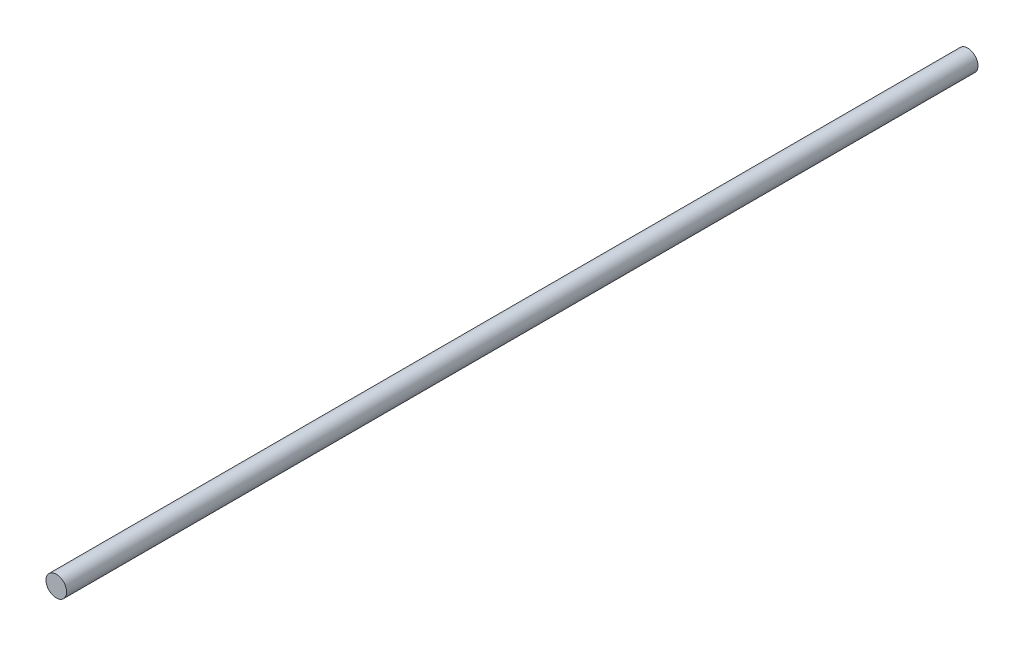
from build123d import *

# Parameters (mm, degrees)
CROQUIS1_R              = 4
SALIENTE_EXTRUIR1_DEPTH = 177


with BuildPart() as part:
    # Croquis1 → Saliente-Extruir1 (new, symmetric)
    with BuildSketch(Plane.XY):
        Circle(CROQUIS1_R)
    extrude(amount=SALIENTE_EXTRUIR1_DEPTH, both=True)


solid = part.part
